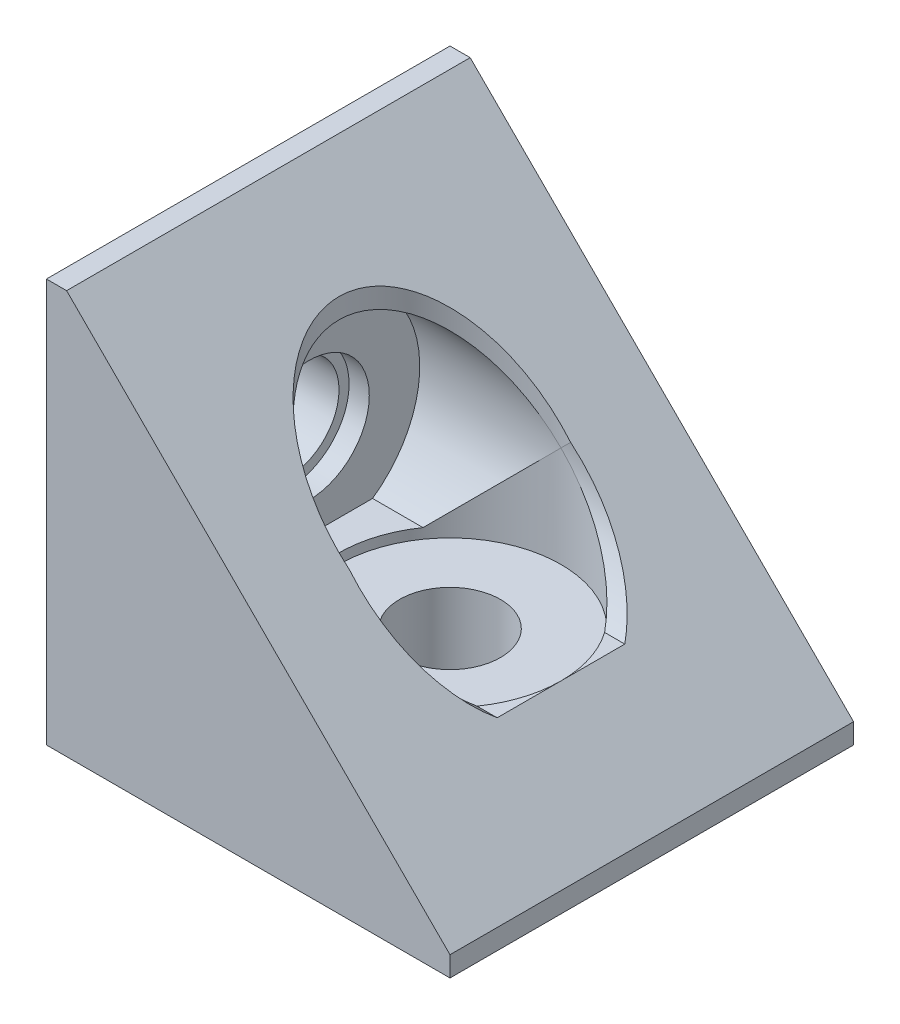
from build123d import *

# Parameters (mm, degrees)
EXTRUDE_1_DEPTH           = 20
SKETCH_2_R                = 5.5
CUT_EXTRUDE_1_DEPTH       = 15
CUT_EXTRUDE_2_DEPTH       = 17
HOLE_WIZARD_M6_1_D        = 5
HOLE_WIZARD_1_D           = 5
HOLE_WIZARD_1_DEPTH       = 14
HOLE_WIZARD_1_CBORE_D     = 6
HOLE_WIZARD_1_CBORE_DEPTH = 1
HOLE_WIZARD_1_TIP         = 1.502151548


with BuildPart() as part:
    # 草图1 → 凸台-拉伸1 (new body)
    with BuildSketch(Plane.XY):
        Polygon((0, 0), (20, 0), (20, 1), (1, 20), (0, 20), align=None)
    extrude(amount=EXTRUDE_1_DEPTH)

    # 草图2 → 切除-拉伸1 (cut)
    with BuildSketch(Plane(origin=(0, 20, 0), x_dir=(1, 0, 0), z_dir=(0, 1, 0))):
        with Locations(Location((10, -10, 0), (0, 0, 270))):
            Circle(SKETCH_2_R)
    extrude(amount=-CUT_EXTRUDE_1_DEPTH, mode=Mode.SUBTRACT)

    # 草图3 → 切除-拉伸2 (cut)
    with BuildSketch(Plane(origin=(20, 0, 0), x_dir=(0, 0, -1), z_dir=(1, 0, 0))):
        with BuildLine():
            Line((-13.16227766, 5.5), (-6.83772234, 5.5))
            ThreePointArc((-6.83772234, 5.5), (-10, 15.5), (-13.16227766, 5.5))
        make_face()
    extrude(amount=-CUT_EXTRUDE_2_DEPTH, mode=Mode.SUBTRACT)

    # M6 螺纹孔1 (through all)
    with Locations(Plane(origin=(0, 5, 0), x_dir=(1, 0, 0), z_dir=(0, 1, 0))):
        with Locations((10, -10)):
            Hole(HOLE_WIZARD_M6_1_D / 2)

    # 打孔尺寸(%根据)内六角圆柱头螺钉的类型1
    with Locations(Plane(origin=(3, 0, 0), x_dir=(0, 0, -1), z_dir=(1, 0, 0))):
        with Locations((-10, 10)):
            CounterBoreHole(HOLE_WIZARD_1_D / 2, HOLE_WIZARD_1_CBORE_D / 2, HOLE_WIZARD_1_CBORE_DEPTH, depth=HOLE_WIZARD_1_DEPTH)
            with Locations((0, 0, -(HOLE_WIZARD_1_DEPTH + HOLE_WIZARD_1_TIP / 2))):  # 118° drill point
                Cone(0, HOLE_WIZARD_1_D / 2, HOLE_WIZARD_1_TIP, mode=Mode.SUBTRACT)


solid = part.part
